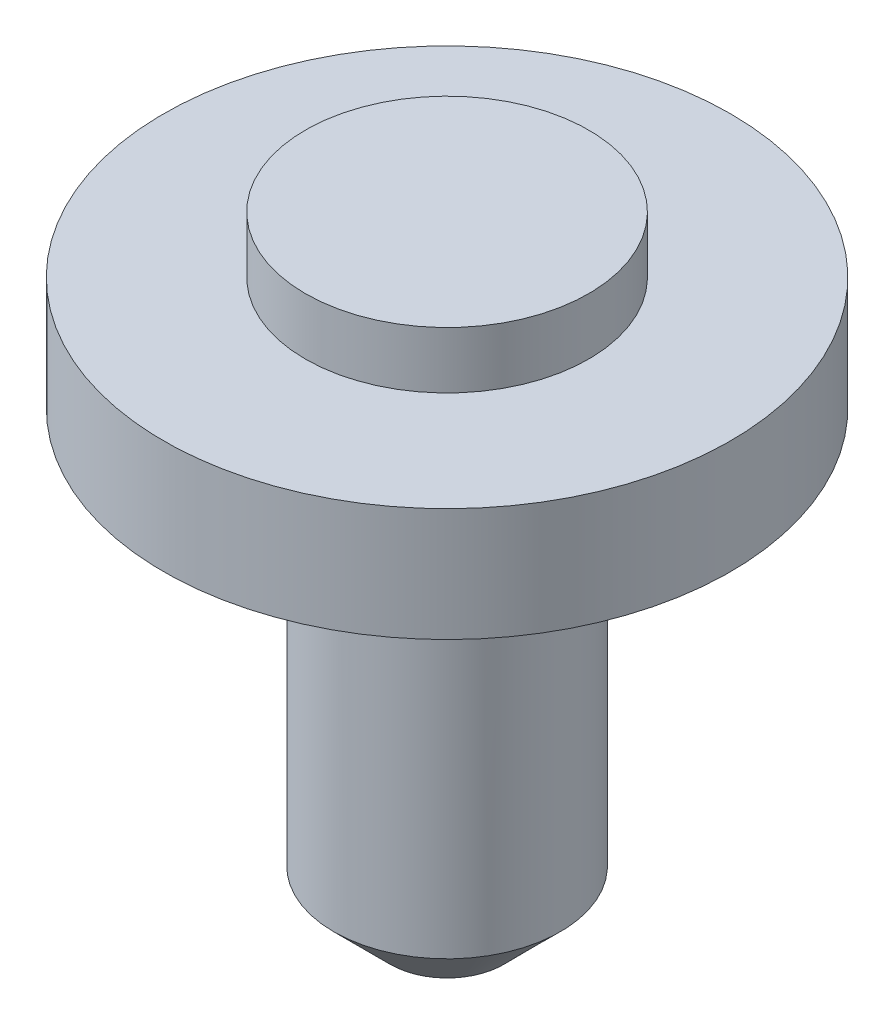
from build123d import *

# Parameters (mm, degrees)
CHAMFER1_SIZE       = 1
SKETCH2_R           = 2.5
BOSS_EXTRUDE1_DEPTH = 1


with BuildPart() as part:
    # Sketch1 → Revolve1 (revolve)
    with BuildSketch(Plane.XY, mode=Mode.PRIVATE) as revolve1_sk:
        Polygon((0, 10), (-5, 10), (-5, 8), (-2.5, 8), (-2.5, 7), (-2, 7), (-2, 0), (-0.35, 0), (-0.35, 9), (0, 9), align=None)
    revolve(revolve1_sk.sketch.rotate(Axis((0, 0, 0), (0, 1, 0)), 270), axis=Axis((0, 0, 0), (0, 1, 0)))

    # Chamfer1
    chamfer1_edges = [part.edges().sort_by_distance(p)[0] for p in [
        (0, 0, 2),
    ]]
    chamfer(chamfer1_edges, length=CHAMFER1_SIZE)

    # Sketch2 → Boss-Extrude1 (add)
    with BuildSketch(Plane(origin=(0, 10, 0), x_dir=(1, 0, 0), z_dir=(0, 1, 0))):
        with Locations(Location((0, 0, 0), (0, 0, 90))):
            Circle(SKETCH2_R)
    extrude(amount=BOSS_EXTRUDE1_DEPTH)


solid = part.part
